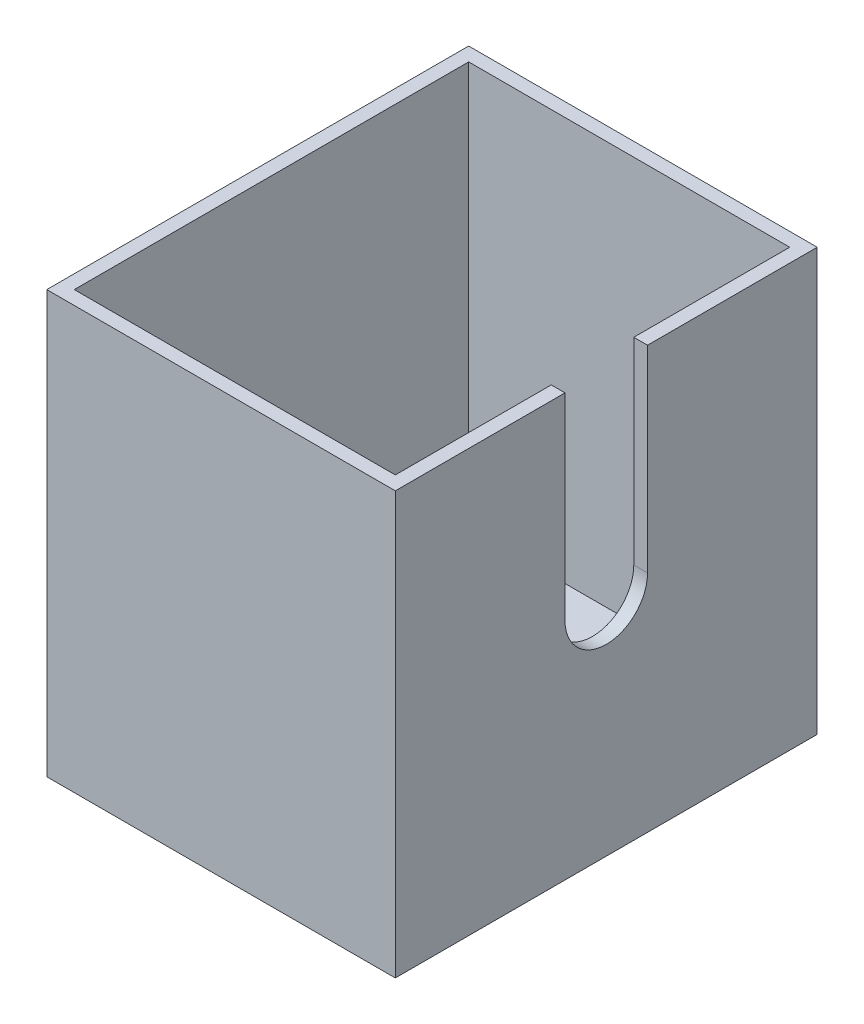
from build123d import *

# Parameters (mm, degrees)
ESQUISSE1_W                   = 44.2
ESQUISSE1_H                   = 52.2
BOSS_EXTRU_1_DEPTH            = 52.2
ENL_V_MAT_EXTRU_2_DEPTH       = 74.209903702
ENL_V_MAT_EXTRU_2_DEPTH_BACK  = 44.2
ENL_V_MAT_EXTRU_3_DEPTH       = 74.209903702
ENL_V_MAT_EXTRU_3_DEPTH_BACK  = 44.2
ENL_V_MAT_EXTRU_4_DEPTH       = 78.059003368
ENL_V_MAT_EXTRU_4_DEPTH_BACK  = 46
ENL_V_MAT_EXTRU_5_DEPTH       = 78.059003368
ENL_V_MAT_EXTRU_5_DEPTH_BACK  = 46
ENL_V_MAT_EXTRU_7_DEPTH       = 45.550224466
ENL_V_MAT_EXTRU_7_DEPTH_BACK  = 45.550224466
ENL_V_MAT_EXTRU_8_DEPTH       = 78.059003368
ENL_V_MAT_EXTRU_8_DEPTH_BACK  = 46
ENL_V_MAT_EXTRU_9_DEPTH       = 75.993733072
ENL_V_MAT_EXTRU_9_DEPTH_BACK  = 46
ESQUISSE13_W                  = 35
ESQUISSE13_H                  = 43
ENL_V_MAT_EXTRU_10_DEPTH      = 44
ENL_V_MAT_EXTRU_11_DEPTH      = 72.032809321
ENL_V_MAT_EXTRU_11_DEPTH_BACK = 1.5
ENL_V_MAT_EXTRU_13_DEPTH      = 72.032809321
ENL_V_MAT_EXTRU_13_DEPTH_BACK = 38
ENL_V_MAT_EXTRU_15_DEPTH      = 71.818217995
ENL_V_MAT_EXTRU_15_DEPTH_BACK = 46


with BuildPart() as part:
    # Esquisse1 → Boss.-Extru.1 (new body)
    with BuildSketch(Plane.XY):
        Rectangle(ESQUISSE1_W, ESQUISSE1_H)
    extrude(amount=BOSS_EXTRU_1_DEPTH)

    # Esquisse2 → Enlèv. mat.-Extru.2 (cut, two sides: drawn at the far end of the back side and taken through both)
    with BuildSketch(Plane(origin=(22.1, 0, 0), x_dir=(0, 0, -1), z_dir=(1, 0, 0)).offset(-ENL_V_MAT_EXTRU_2_DEPTH_BACK)):
        Polygon((-201.352290675, -19.9), (-52.2, -19.9), (-28.55, -19.9), (-28.55, -21.45), (-32.25, -21.45), (-32.25, -22.45), (-28.745559959, -26.1), (74.553898465, -133.690091099), (-39.180744024, -409.461834307), (-315.086933163, -295.671743208), align=None)
    extrude(amount=ENL_V_MAT_EXTRU_2_DEPTH + ENL_V_MAT_EXTRU_2_DEPTH_BACK, mode=Mode.SUBTRACT)

    # Esquisse3 → Enlèv. mat.-Extru.3 (cut, two sides: drawn at the far end of the back side and taken through both)
    with BuildSketch(Plane(origin=(22.1, 0, 0), x_dir=(0, 0, -1), z_dir=(1, 0, 0)).offset(-ENL_V_MAT_EXTRU_3_DEPTH_BACK)):
        Polygon((149.152290675, -19.9), (0, -19.9), (-23.65, -19.9), (-23.65, -21.45), (-19.95, -21.45), (-19.95, -22.45), (-23.454440041, -26.1), (-126.753898465, -133.690091099), (-13.019255976, -409.461834307), (262.886933163, -295.671743208), align=None)
    extrude(amount=ENL_V_MAT_EXTRU_3_DEPTH + ENL_V_MAT_EXTRU_3_DEPTH_BACK, mode=Mode.SUBTRACT)

    # Esquisse4 → Enlèv. mat.-Extru.4 (cut, two sides: drawn at the far end of the back side and taken through both)
    with BuildSketch(Plane(origin=(0, 26.1, 0), x_dir=(1, 0, 0), z_dir=(0, 1, 0)).offset(-ENL_V_MAT_EXTRU_4_DEPTH_BACK)):
        Polygon((-15.9, -191.333109619), (-15.9, -52.2), (-15.9, -28.55), (-17.45, -28.55), (-17.45, -32.25), (-18.45, -32.25), (-22.1, -28.745559959), (-122.462816227, 67.614843274), (-379.791464965, -38.281593439), (-273.228648738, -297.229546332), align=None)
    extrude(amount=ENL_V_MAT_EXTRU_4_DEPTH + ENL_V_MAT_EXTRU_4_DEPTH_BACK, mode=Mode.SUBTRACT)

    # Esquisse5 → Enlèv. mat.-Extru.5 (cut, two sides: drawn at the far end of the back side and taken through both)
    with BuildSketch(Plane(origin=(0, 26.1, 0), x_dir=(1, 0, 0), z_dir=(0, 1, 0)).offset(-ENL_V_MAT_EXTRU_5_DEPTH_BACK)):
        Polygon((-15.9, 139.133109619), (-15.9, 0), (-15.9, -23.65), (-17.45, -23.65), (-17.45, -19.95), (-18.45, -19.95), (-22.1, -23.454440041), (-122.462816228, -119.814843274), (-379.791464965, -13.918406561), (-273.228648738, 245.029546332), align=None)
    extrude(amount=ENL_V_MAT_EXTRU_5_DEPTH + ENL_V_MAT_EXTRU_5_DEPTH_BACK, mode=Mode.SUBTRACT)

    # Esquisse6 → Enlèv. mat.-Extru.7 (cut, two sides: drawn at the far end of the back side and taken through both)
    with BuildSketch(Plane.XY.offset(28.55).offset(-ENL_V_MAT_EXTRU_7_DEPTH_BACK)):
        Polygon((-161.22284167, -19.9), (-22.1, -19.9), (-15.9, -19.9), (-15.9, -26.093649616), (-15.9, -165.216491285), (-212.645110561, -361.97019968), (-357.967952231, -216.653708395), align=None)
    extrude(amount=ENL_V_MAT_EXTRU_7_DEPTH + ENL_V_MAT_EXTRU_7_DEPTH_BACK, mode=Mode.SUBTRACT)

    # Esquisse11 → Enlèv. mat.-Extru.8 (cut, two sides: drawn at the far end of the back side and taken through both)
    with BuildSketch(Plane(origin=(0, 26.1, 0), x_dir=(1, 0, 0), z_dir=(0, 1, 0)).offset(-ENL_V_MAT_EXTRU_8_DEPTH_BACK)):
        Polygon((164.227968273, -49.1), (22.1, -49.1), (-15.9, -49.1), (-158.027968273, -49.1), (-158.027968273, -333.355936546), (164.227968273, -333.355936546), align=None)
    extrude(amount=ENL_V_MAT_EXTRU_8_DEPTH + ENL_V_MAT_EXTRU_8_DEPTH_BACK, mode=Mode.SUBTRACT)

    # Esquisse12 → Enlèv. mat.-Extru.9 (cut, two sides: drawn at the far end of the back side and taken through both)
    with BuildSketch(Plane(origin=(0, 26.1, 0), x_dir=(1, 0, 0), z_dir=(0, 1, 0)).offset(-ENL_V_MAT_EXTRU_9_DEPTH_BACK)):
        Polygon((159.687460199, -3.1), (22.1, -3.1), (-15.9, -3.1), (-153.487460199, -3.1), (-153.487460199, 272.074920398), (159.687460199, 272.074920398), align=None)
    extrude(amount=ENL_V_MAT_EXTRU_9_DEPTH + ENL_V_MAT_EXTRU_9_DEPTH_BACK, mode=Mode.SUBTRACT)

    # Esquisse13 → Enlèv. mat.-Extru.10 (cut)
    with BuildSketch(Plane(origin=(0, 26.1, 0), x_dir=(1, 0, 0), z_dir=(0, 1, 0))):
        with Locations((3.1, -26.1)):
            Rectangle(ESQUISSE13_W, ESQUISSE13_H)
    extrude(amount=-ENL_V_MAT_EXTRU_10_DEPTH, mode=Mode.SUBTRACT)

    # Esquisse14 → Enlèv. mat.-Extru.11 (cut, two sides: drawn at the far end of the back side and taken through both)
    with BuildSketch(Plane(origin=(22.1, 0, 0), x_dir=(0, 0, -1), z_dir=(1, 0, 0)).offset(-ENL_V_MAT_EXTRU_11_DEPTH_BACK)):
        with BuildLine():
            Line((-21.6, 4.6), (-21.6, 26.1))
            Line((-21.6, 26.1), (-30.6, 26.1))
            Line((-30.6, 26.1), (-30.6, 4.6))
            ThreePointArc((-30.6, 4.6), (-26.1, 0.1), (-21.6, 4.6))
        make_face()
    extrude(amount=ENL_V_MAT_EXTRU_11_DEPTH + ENL_V_MAT_EXTRU_11_DEPTH_BACK, mode=Mode.SUBTRACT)

    # Esquisse15 → Enlèv. mat.-Extru.13 (cut, two sides: drawn at the far end of the back side and taken through both)
    with BuildSketch(Plane(origin=(22.1, 0, 0), x_dir=(0, 0, -1), z_dir=(1, 0, 0)).offset(-ENL_V_MAT_EXTRU_13_DEPTH_BACK)):
        Polygon((-143.691856556, -19.9), (-28.55, -19.9), (-23.65, -19.9), (91.491856556, -19.9), (91.491856556, -250.183713112), (-143.691856556, -250.183713112), align=None)
    extrude(amount=ENL_V_MAT_EXTRU_13_DEPTH + ENL_V_MAT_EXTRU_13_DEPTH_BACK, mode=Mode.SUBTRACT)

    # Esquisse16 → Enlèv. mat.-Extru.15 (cut, two sides: drawn at the far end of the back side and taken through both)
    with BuildSketch(Plane(origin=(0, -19.9, 0), x_dir=(-1, 0, 0), z_dir=(0, -1, 0)).offset(-ENL_V_MAT_EXTRU_15_DEPTH_BACK)):
        Polygon((15.9, -130.020268394), (15.9, -28.55), (15.9, -23.65), (15.9, 77.820268394), (218.840536787, 77.820268394), (218.840536787, -130.020268394), align=None)
    extrude(amount=ENL_V_MAT_EXTRU_15_DEPTH + ENL_V_MAT_EXTRU_15_DEPTH_BACK, mode=Mode.SUBTRACT)


solid = part.part
